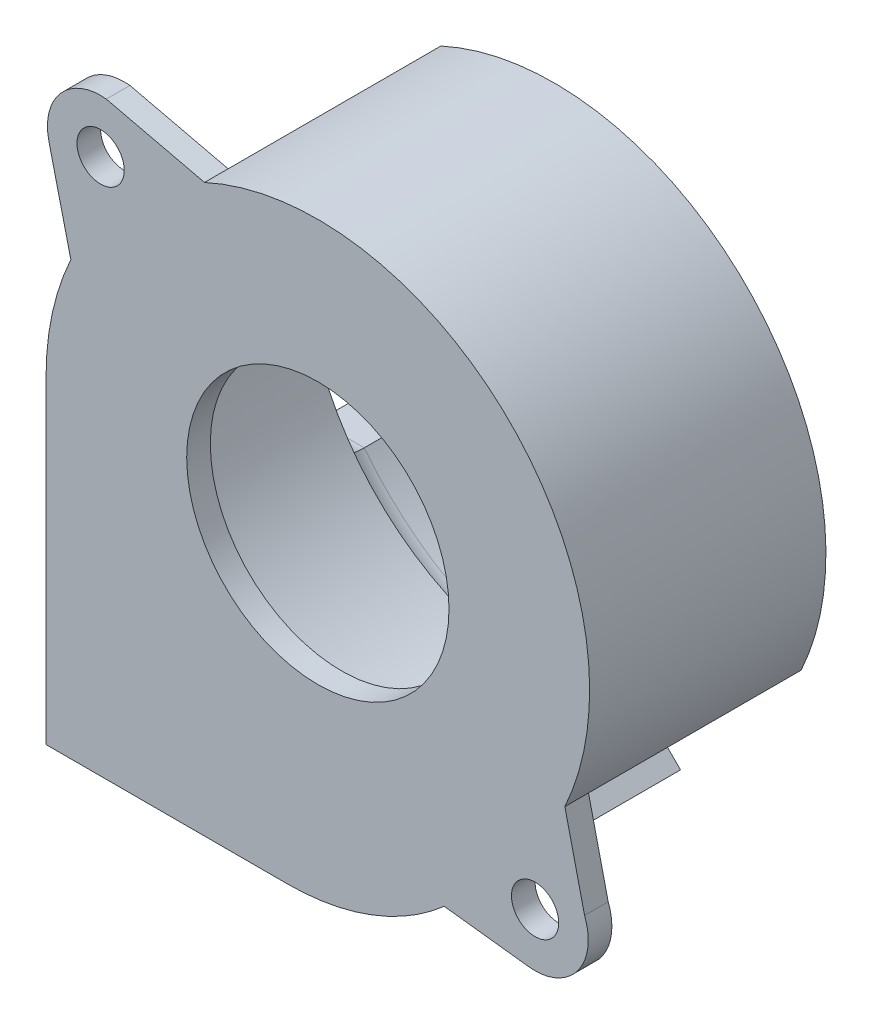
from build123d import *

# Parameters (mm, degrees)
SKETCH_1_R           = 11.1
EXTRUDE_1_DEPTH      = 20
SKETCH_3_R           = 21.1
CUT_EXTRUDE_11_DEPTH = 18
EXTRUDE_2_DEPTH      = 20
FILLET_3_R           = 3
SKETCH_5_R           = 1.5
CUT_EXTRUDE_12_DEPTH = 5
CUT_EXTRUDE_13_DEPTH = 18
SKETCH_7_R           = 2
EXTRUDE_3_DEPTH      = 2
EXTRUDE_4_DEPTH      = 2


with BuildPart() as part:
    # 草图1 → 凸台-拉伸1 (new body)
    with BuildSketch(Plane.XY):
        with BuildLine():
            Line((-23, 0), (-23, -27))
            Line((-23, -27), (-2.527032193, -27))
            ThreePointArc((-2.527032193, -27), (6.11037495, -25.038713863), (13.053739404, -19.539519785))
            ThreePointArc((13.053739404, -19.539519785), (14.135978403, -18.302517785), (15.316133792, -17.158556049))
            ThreePointArc((15.316133792, -17.158556049), (9.400237305, 20.991320554), (-23, 0))
        make_face()
        Circle(SKETCH_1_R, mode=Mode.SUBTRACT)
    extrude(amount=EXTRUDE_1_DEPTH)

    # 草图3 → 切除-拉伸11 (cut)
    with BuildSketch(Plane(origin=(0, 0, 0), x_dir=(-1, 0, 0), z_dir=(0, 0, -1))):
        Circle(SKETCH_3_R)
    extrude(amount=-CUT_EXTRUDE_11_DEPTH, mode=Mode.SUBTRACT)

    # 草图4 → 凸台-拉伸2 (add)
    with BuildSketch(Plane(origin=(0, 0, 0), x_dir=(-1, 0, 0), z_dir=(0, 0, -1))):
        with BuildLine():
            Line((2.527032193, -24), (2.527032193, -27))
            Line((2.527032193, -27), (23, -27))
            Line((23, -27), (23, -24))
            Line((23, -24), (23, -14.78470732))
            Line((23, -14.78470732), (19.073497874, -14.78470732))
            ThreePointArc((19.073497874, -14.78470732), (11.742066666, -21.083400155), (2.527032193, -24))
        make_face()
    extrude(amount=EXTRUDE_2_DEPTH)

    # 圆角3
    fillet_3_edges = [part.edges().sort_by_distance(p)[0] for p in [
        (-21.036748937, -14.78470732, 0),
        (-11.742066666, -21.083400155, 0),
        (-2.527032193, -25.5, 0),
    ]]
    fillet(fillet_3_edges, radius=FILLET_3_R)

    # 草图5 → 切除-拉伸12 (cut)
    with BuildSketch(Plane.XZ.offset(27)):
        with Locations(Location((-18, 14, 0), (0, 0, 270))):
            Circle(SKETCH_5_R)
        with Locations(Location((-6.527032193, 14, 0), (0, 0, 270))):
            Circle(SKETCH_5_R)
        with Locations(Location((-6.527032193, -16, 0), (0, 0, 270))):
            Circle(SKETCH_5_R)
        with Locations(Location((-18, -16, 0), (0, 0, 90))):
            Circle(SKETCH_5_R)
    extrude(amount=-CUT_EXTRUDE_12_DEPTH, mode=Mode.SUBTRACT)

    # 草图6 → 切除-拉伸13 (cut)
    with BuildSketch(Plane(origin=(0, 0, 0), x_dir=(-1, 0, 0), z_dir=(0, 0, -1))):
        with BuildLine():
            ThreePointArc((-20.904804931, -9.591096432), (-18.881207588, -13.133925537), (-16.263455967, -16.263455967))
            Line((-16.263455967, -16.263455967), (-14.919953083, -14.919953083))
            ThreePointArc((-14.919953083, -14.919953083), (-17.52155815, -11.756062266), (-19.462831216, -8.149122717))
            Line((-19.462831216, -8.149122717), (-20.904804931, -9.591096432))
        make_face()
        with BuildLine():
            ThreePointArc((8.149122717, 19.462831216), (11.756062266, 17.52155815), (14.919953083, 14.919953083))
            Line((14.919953083, 14.919953083), (16.263455967, 16.263455967))
            ThreePointArc((16.263455967, 16.263455967), (13.133925537, 18.881207588), (9.591096432, 20.904804931))
            Line((9.591096432, 20.904804931), (8.149122717, 19.462831216))
        make_face()
        with BuildLine():
            Line((-14.919953083, -14.919953083), (-16.263455967, -16.263455967))
            ThreePointArc((-16.263455967, -16.263455967), (-15.796136343, -16.717717447), (-15.316133792, -17.158556049))
            ThreePointArc((-15.316133792, -17.158556049), (-14.135978403, -18.302517785), (-13.053739404, -19.539519785))
            ThreePointArc((-13.053739404, -19.539519785), (-11.926392495, -20.823838642), (-10.693521638, -22.007230137))
            Line((-10.693521638, -22.007230137), (-8.149122717, -19.462831216))
            ThreePointArc((-8.149122717, -19.462831216), (-11.756062266, -17.52155815), (-14.919953083, -14.919953083))
        make_face()
        with BuildLine():
            Line((16.263455967, 16.263455967), (14.919953083, 14.919953083))
            ThreePointArc((14.919953083, 14.919953083), (17.52155815, 11.756062266), (19.462831216, 8.149122717))
            Line((19.462831216, 8.149122717), (20.904804931, 9.591096432))
            ThreePointArc((20.904804931, 9.591096432), (18.881207588, 13.133925537), (16.263455967, 16.263455967))
        make_face()
        with BuildLine():
            ThreePointArc((-20.904804931, -9.591096432), (-18.881207588, -13.133925537), (-16.263455967, -16.263455967))
            Line((-16.263455967, -16.263455967), (-14.919953083, -14.919953083))
            ThreePointArc((-14.919953083, -14.919953083), (-17.52155815, -11.756062266), (-19.462831216, -8.149122717))
            Line((-19.462831216, -8.149122717), (-20.904804931, -9.591096432))
        make_face()
        with BuildLine():
            ThreePointArc((8.149122717, 19.462831216), (11.756062266, 17.52155815), (14.919953083, 14.919953083))
            Line((14.919953083, 14.919953083), (16.263455967, 16.263455967))
            ThreePointArc((16.263455967, 16.263455967), (13.133925537, 18.881207588), (9.591096432, 20.904804931))
            Line((9.591096432, 20.904804931), (8.149122717, 19.462831216))
        make_face()
    extrude(amount=-CUT_EXTRUDE_13_DEPTH, mode=Mode.SUBTRACT)

    # 草图7 → 凸台-拉伸3 (add)
    # profile 1 of 2: a face of its own
    with BuildSketch(Plane(origin=(0, 0, 18), x_dir=(-1, 0, 0), z_dir=(0, 0, -1))):
        with BuildLine():
            Line((-20.904804931, -9.591096432), (-22.572553276, -16.737802089))
            ThreePointArc((-22.572553276, -16.737802089), (-21.948390933, -21.13262107), (-17.856697376, -22.853683631))
            Line((-17.856697376, -22.853683631), (-10.693521638, -22.007230137))
            ThreePointArc((-10.693521638, -22.007230137), (-11.926392495, -20.823838642), (-13.053739404, -19.539519785))
            ThreePointArc((-13.053739404, -19.539519785), (-14.135978403, -18.302517785), (-15.316133792, -17.158556049))
            ThreePointArc((-15.316133792, -17.158556049), (-18.501505662, -13.66361183), (-20.904804931, -9.591096432))
        make_face()
        with Locations((-18.384776311, -18.384776311)):
            Circle(SKETCH_7_R, mode=Mode.SUBTRACT)
    # profile 2 of 2: a face of its own
    with BuildSketch(Plane(origin=(0, 0, 18), x_dir=(-1, 0, 0), z_dir=(0, 0, -1))):
        with BuildLine():
            Line((16.822428117, 22.604855471), (9.591096432, 20.904804931))
            ThreePointArc((9.591096432, 20.904804931), (16.263455967, 16.263455967), (20.904804931, 9.591096432))
            Line((20.904804931, 9.591096432), (22.760868508, 17.336054667))
            ThreePointArc((22.760868508, 17.336054667), (21.763719501, 21.356769399), (17.903153402, 22.858928675))
            Line((17.903153402, 22.858928675), (16.822428117, 22.604855471))
        make_face()
        with Locations((18.384776311, 18.384776311)):
            Circle(SKETCH_7_R, mode=Mode.SUBTRACT)
    extrude(amount=-EXTRUDE_3_DEPTH)

    # 草图8 → 凸台-拉伸4 (add)
    with BuildSketch(Plane(origin=(0, 0, -20), x_dir=(-1, 0, 0), z_dir=(0, 0, -1))):
        with BuildLine():
            Line((2.527032193, -24), (2.527032193, -27))
            Line((2.527032193, -27), (23, -27))
            Line((23, -27), (23, -14.78470732))
            Line((23, -14.78470732), (19.073497874, -14.78470732))
            ThreePointArc((19.073497874, -14.78470732), (11.742066666, -21.083400155), (2.527032193, -24))
        make_face()
    extrude(amount=EXTRUDE_4_DEPTH)


solid = part.part
